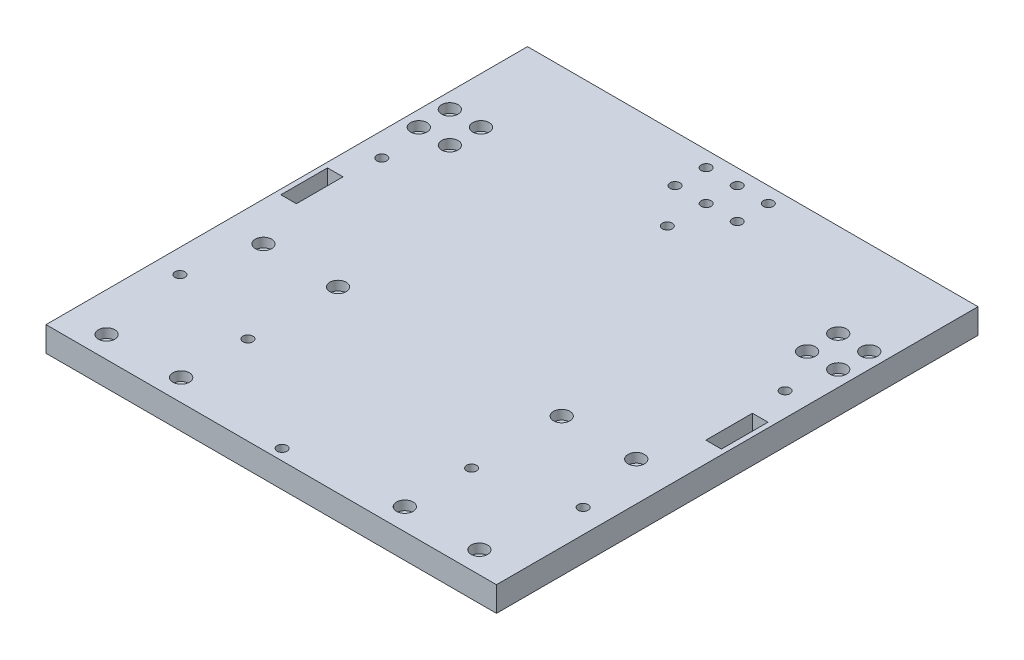
from build123d import *

# Parameters (mm, degrees)
SKETCH1_W           = 145
SKETCH1_H           = 155
SKETCH1_R           = 1.6
SKETCH1_W_2         = 5
SKETCH1_H_2         = 15
BOSS_EXTRUDE1_DEPTH = 8
SKETCH2_R           = 2.65
CUT_EXTRUDE1_DEPTH  = 3
SKETCH3_R           = 2.65
CUT_EXTRUDE3_DEPTH  = 3


with BuildPart() as part:
    # Sketch1 → Boss-Extrude1 (new body)
    with BuildSketch(Plane(origin=(0, 0, 0), x_dir=(1, 0, 0), z_dir=(0, 1, 0))):
        Rectangle(SKETCH1_W, SKETCH1_H)
        with Locations(Location((-60, -70.5, 0), (0, 0, 270))):
            Circle(SKETCH1_R, mode=Mode.SUBTRACT)
        with Locations(Location((-36, -70.5, 0), (0, 0, 270))):
            Circle(SKETCH1_R, mode=Mode.SUBTRACT)
        with Locations(Location((-36, -20, 0), (0, 0, 270))):
            Circle(SKETCH1_R, mode=Mode.SUBTRACT)
        with Locations(Location((-60, -20, 0), (0, 0, 270))):
            Circle(SKETCH1_R, mode=Mode.SUBTRACT)
        with Locations(Location((60, -70.5, 0), (0, 0, 270))):
            Circle(SKETCH1_R, mode=Mode.SUBTRACT)
        with Locations(Location((36, -70.5, 0), (0, 0, 270))):
            Circle(SKETCH1_R, mode=Mode.SUBTRACT)
        with Locations(Location((36, -20, 0), (0, 0, 270))):
            Circle(SKETCH1_R, mode=Mode.SUBTRACT)
        with Locations(Location((60, -20, 0), (0, 0, 270))):
            Circle(SKETCH1_R, mode=Mode.SUBTRACT)
        with Locations(Location((-67.5, 47.5, 0), (0, 0, 270))):
            Circle(SKETCH1_R, mode=Mode.SUBTRACT)
        with Locations(Location((-57.5, 47.5, 0), (0, 0, 270))):
            Circle(SKETCH1_R, mode=Mode.SUBTRACT)
        with Locations(Location((-57.5, 37.5, 0), (0, 0, 270))):
            Circle(SKETCH1_R, mode=Mode.SUBTRACT)
        with Locations(Location((-67.5, 37.5, 0), (0, 0, 270))):
            Circle(SKETCH1_R, mode=Mode.SUBTRACT)
        with Locations(Location((67.5, 47.5, 0), (0, 0, 270))):
            Circle(SKETCH1_R, mode=Mode.SUBTRACT)
        with Locations(Location((57.5, 47.5, 0), (0, 0, 270))):
            Circle(SKETCH1_R, mode=Mode.SUBTRACT)
        with Locations(Location((57.5, 37.5, 0), (0, 0, 270))):
            Circle(SKETCH1_R, mode=Mode.SUBTRACT)
        with Locations(Location((67.5, 37.5, 0), (0, 0, 270))):
            Circle(SKETCH1_R, mode=Mode.SUBTRACT)
        with Locations(Location((0, -74, 0), (0, 0, 270))):
            Circle(SKETCH1_R, mode=Mode.SUBTRACT)
        with Locations(Location((36, -49, 0), (0, 0, 270))):
            Circle(SKETCH1_R, mode=Mode.SUBTRACT)
        with Locations(Location((-36, -49, 0), (0, 0, 270))):
            Circle(SKETCH1_R, mode=Mode.SUBTRACT)
        with Locations(Location((-64.9, -42, 0), (0, 0, 270))):
            Circle(SKETCH1_R, mode=Mode.SUBTRACT)
        with Locations(Location((-64.9, 23, 0), (0, 0, 270))):
            Circle(SKETCH1_R, mode=Mode.SUBTRACT)
        with Locations(Location((0, 50, 0), (0, 0, 270))):
            Circle(SKETCH1_R, mode=Mode.SUBTRACT)
        with Locations(Location((64.9, -42, 0), (0, 0, 270))):
            Circle(SKETCH1_R, mode=Mode.SUBTRACT)
        with Locations(Location((64.9, 23, 0), (0, 0, 270))):
            Circle(SKETCH1_R, mode=Mode.SUBTRACT)
        with Locations(Location((-10, 72.5, 0), (0, 0, 270))):
            Circle(SKETCH1_R, mode=Mode.SUBTRACT)
        with Locations(Location((0, 72.5, 0), (0, 0, 270))):
            Circle(SKETCH1_R, mode=Mode.SUBTRACT)
        with Locations(Location((10, 62.5, 0), (0, 0, 270))):
            Circle(SKETCH1_R, mode=Mode.SUBTRACT)
        with Locations(Location((0, 62.5, 0), (0, 0, 270))):
            Circle(SKETCH1_R, mode=Mode.SUBTRACT)
        with Locations(Location((-10, 62.5, 0), (0, 0, 270))):
            Circle(SKETCH1_R, mode=Mode.SUBTRACT)
        with Locations(Location((10, 72.5, 0), (0, 0, 270))):
            Circle(SKETCH1_R, mode=Mode.SUBTRACT)
        with Locations((-68.4, 4)):
            Rectangle(SKETCH1_W_2, SKETCH1_H_2, mode=Mode.SUBTRACT)
        with Locations((68.4, 4)):
            Rectangle(SKETCH1_W_2, SKETCH1_H_2, mode=Mode.SUBTRACT)
    extrude(amount=BOSS_EXTRUDE1_DEPTH)

    # Sketch2 → Cut-Extrude1 (cut)
    with BuildSketch(Plane(origin=(0, 8, 0), x_dir=(1, 0, 0), z_dir=(0, 1, 0))):
        with Locations(Location((-57.5, 47.5, 0), (0, 0, 270))):
            Circle(SKETCH2_R)
        with Locations(Location((-67.5, 47.5, 0), (0, 0, 270))):
            Circle(SKETCH2_R)
        with Locations(Location((-57.5, 37.5, 0), (0, 0, 270))):
            Circle(SKETCH2_R)
        with Locations(Location((-67.5, 37.5, 0), (0, 0, 270))):
            Circle(SKETCH2_R)
        with Locations(Location((67.5, 47.5, 0), (0, 0, 90))):
            Circle(SKETCH2_R)
        with Locations(Location((57.5, 47.5, 0), (0, 0, 90))):
            Circle(SKETCH2_R)
        with Locations(Location((57.5, 37.5, 0), (0, 0, 90))):
            Circle(SKETCH2_R)
        with Locations(Location((67.5, 37.5, 0), (0, 0, 90))):
            Circle(SKETCH2_R)
        with Locations(Location((-36, -70.5, 0), (0, 0, 270))):
            Circle(SKETCH2_R)
        with Locations(Location((-60, -70.5, 0), (0, 0, 270))):
            Circle(SKETCH2_R)
        with Locations(Location((-36, -20, 0), (0, 0, 270))):
            Circle(SKETCH2_R)
        with Locations(Location((-60, -20, 0), (0, 0, 270))):
            Circle(SKETCH2_R)
        with Locations(Location((36, -70.5, 0), (0, 0, 90))):
            Circle(SKETCH2_R)
        with Locations(Location((60, -70.5, 0), (0, 0, 90))):
            Circle(SKETCH2_R)
        with Locations(Location((36, -20, 0), (0, 0, 90))):
            Circle(SKETCH2_R)
        with Locations(Location((60, -20, 0), (0, 0, 90))):
            Circle(SKETCH2_R)
    extrude(amount=-CUT_EXTRUDE1_DEPTH, mode=Mode.SUBTRACT)

    # Sketch3 → Cut-Extrude3 (cut)
    with BuildSketch(Plane(origin=(0, 0, 0), x_dir=(1, 0, 0), z_dir=(0, 1, 0))):
        with Locations(Location((0, 50, 0), (0, 0, 270))):
            Circle(SKETCH3_R)
        with Locations(Location((-64.9, 23, 0), (0, 0, 270))):
            Circle(SKETCH3_R)
        with Locations(Location((-64.9, -42, 0), (0, 0, 270))):
            Circle(SKETCH3_R)
        with Locations(Location((-36, -49, 0), (0, 0, 270))):
            Circle(SKETCH3_R)
        with Locations(Location((0, -74, 0), (0, 0, 270))):
            Circle(SKETCH3_R)
        with Locations(Location((36, -49, 0), (0, 0, 90))):
            Circle(SKETCH3_R)
        with Locations(Location((64.9, -42, 0), (0, 0, 90))):
            Circle(SKETCH3_R)
        with Locations(Location((64.9, 23, 0), (0, 0, 90))):
            Circle(SKETCH3_R)
    extrude(amount=CUT_EXTRUDE3_DEPTH, mode=Mode.SUBTRACT)


solid = part.part
